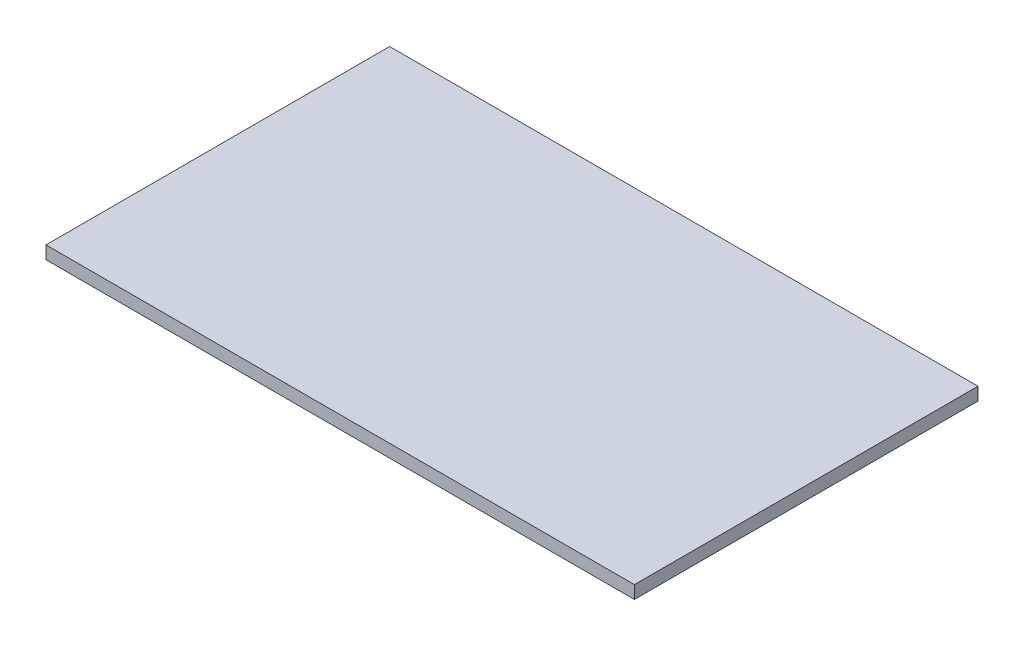
from build123d import *

# Parameters (mm, degrees)
SKETCH1_W           = 137
SKETCH1_H           = 80
BOSS_EXTRUDE1_DEPTH = 3


with BuildPart() as part:
    # Sketch1 → Boss-Extrude1 (new body)
    with BuildSketch(Plane(origin=(0, 0, 0), x_dir=(1, 0, 0), z_dir=(0, 1, 0))):
        with Locations((-30.061629855, 42.400283223)):
            Rectangle(SKETCH1_W, SKETCH1_H)
    extrude(amount=BOSS_EXTRUDE1_DEPTH)


solid = part.part
